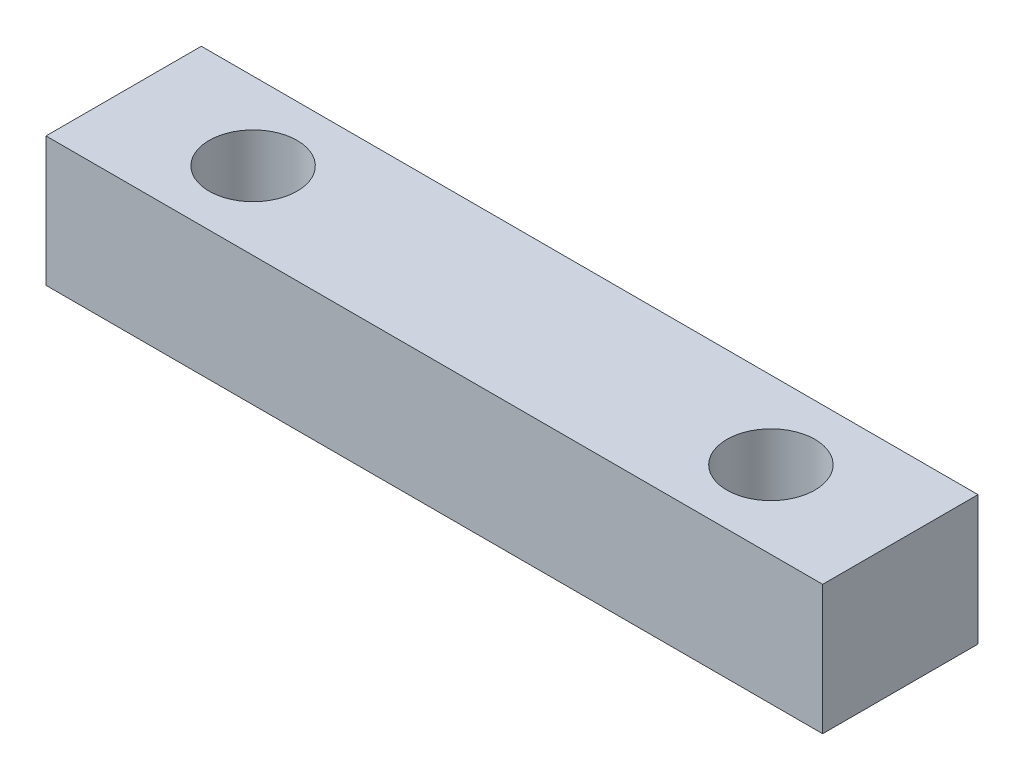
from build123d import *

# Parameters (mm, degrees)
ESQUISSE1_W          = 30
ESQUISSE1_H          = 6
BOSS_EXTRU_1_DEPTH   = 5
D_GAGEMENT_M31_D     = 3.4
D_GAGEMENT_M31_DEPTH = 5
D_GAGEMENT_M31_TIP   = 1.021463052


with BuildPart() as part:
    # Esquisse1 → Boss.-Extru.1 (new body)
    with BuildSketch(Plane(origin=(0, 0, 0), x_dir=(1, 0, 0), z_dir=(0, 1, 0))):
        Rectangle(ESQUISSE1_W, ESQUISSE1_H)
    extrude(amount=BOSS_EXTRU_1_DEPTH)

    # Dégagement M31
    with Locations(Plane.XZ):
        with Locations((10, 0), (-10, 0)):
            Hole(D_GAGEMENT_M31_D / 2, depth=D_GAGEMENT_M31_DEPTH)
            with Locations((0, 0, -(D_GAGEMENT_M31_DEPTH + D_GAGEMENT_M31_TIP / 2))):  # 118° drill point
                Cone(0, D_GAGEMENT_M31_D / 2, D_GAGEMENT_M31_TIP, mode=Mode.SUBTRACT)


solid = part.part
